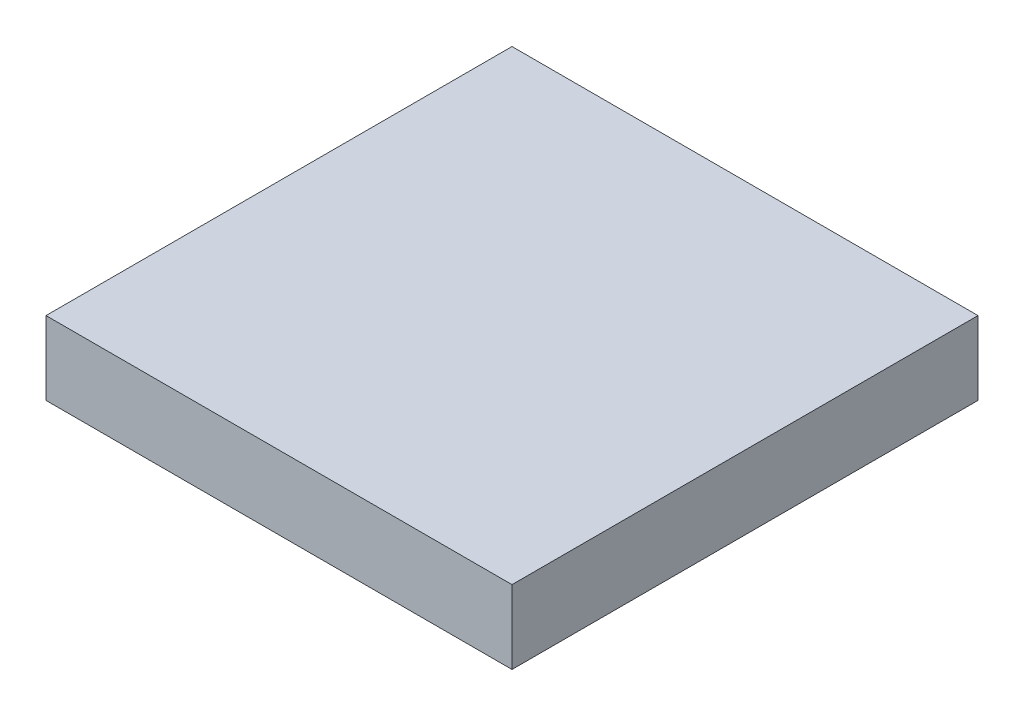
from build123d import *

# Parameters (mm, degrees)
SKETCH1_W           = 29.8
SKETCH1_H           = 29.8
BOSS_EXTRUDE1_DEPTH = 4.7


with BuildPart() as part:
    # Sketch1 → Boss-Extrude1 (new body)
    with BuildSketch(Plane(origin=(0, 0, 0), x_dir=(1, 0, 0), z_dir=(0, 1, 0))):
        Rectangle(SKETCH1_W, SKETCH1_H)
    extrude(amount=BOSS_EXTRUDE1_DEPTH)


solid = part.part
